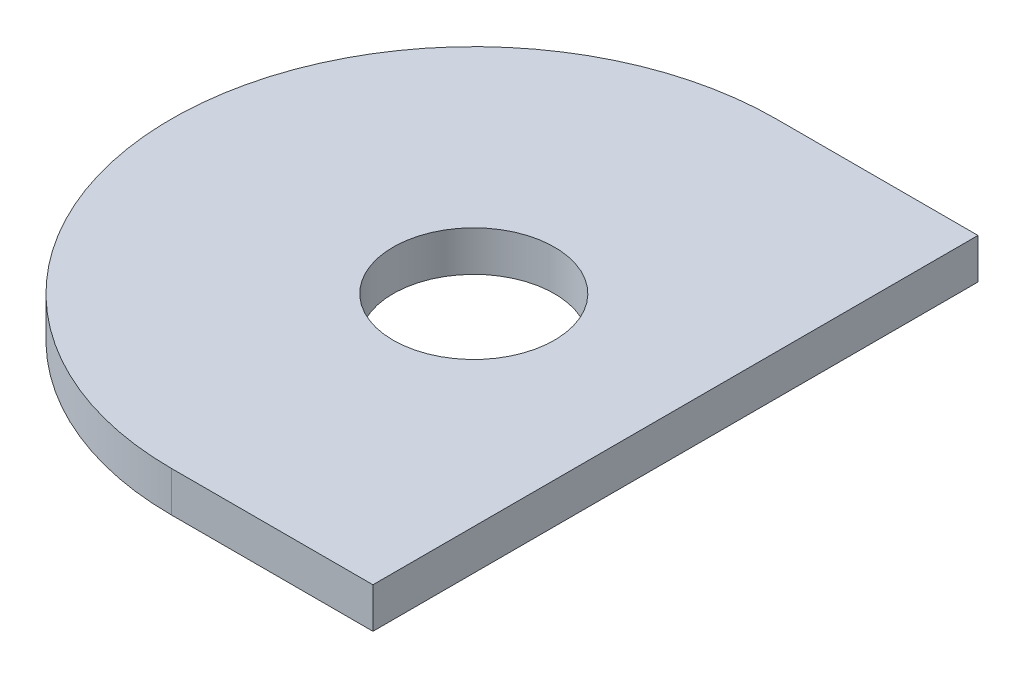
from build123d import *

# Parameters (mm, degrees)
SKETCH1_R           = 8
BOSS_EXTRUDE1_DEPTH = 4


with BuildPart() as part:
    # Sketch1 → Boss-Extrude1 (new body)
    with BuildSketch(Plane(origin=(0, 0, 0), x_dir=(1, 0, 0), z_dir=(0, 1, 0))):
        with BuildLine():
            Line((0, 60), (20, 60))
            Line((20, 60), (20, 0))
            Line((20, 0), (0, 0))
            ThreePointArc((0, 0), (-30, 30), (0, 60))
        make_face()
        with Locations(Location((0, 30, 0), (0, 0, 270))):
            Circle(SKETCH1_R, mode=Mode.SUBTRACT)
    extrude(amount=BOSS_EXTRUDE1_DEPTH)


solid = part.part
